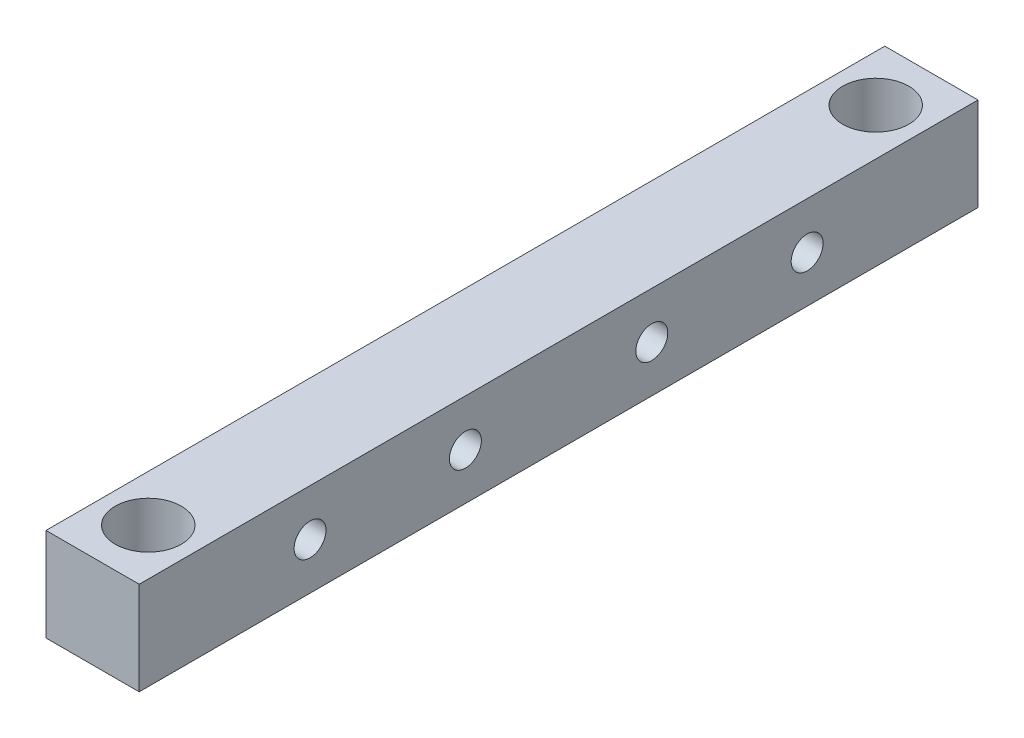
from build123d import *

# Parameters (mm, degrees)
SKETCH1_W               = 9.525
SKETCH1_H               = 9.525
BOSS_EXTRUDE1_DEPTH     = 42.8625
F_1_4_CLEARANCE_HOLE1_D = 6.7564
F_4_CLEARANCE_HOLE1_D   = 3.2639


with BuildPart() as part:
    # Sketch1 → Boss-Extrude1 (new, symmetric)
    with BuildSketch(Plane.XY):
        Rectangle(SKETCH1_W, SKETCH1_H)
    extrude(amount=BOSS_EXTRUDE1_DEPTH, both=True)

    # 1/4 Clearance Hole1 (through all)
    with Locations(Plane(origin=(0, 4.7625, 0), x_dir=(1, 0, 0), z_dir=(0, 1, 0))):
        with Locations((0, 37.1729)):
            f_1_4_clearance_hole1 = Hole(F_1_4_CLEARANCE_HOLE1_D / 2)

    # Mirror1: 1/4 Clearance Hole1 across plane
    add(f_1_4_clearance_hole1.mirror(Plane.XY), mode=Mode.SUBTRACT)

    # #4 Clearance Hole1 (through all)
    with Locations(Plane(origin=(4.7625, 0, 0), x_dir=(0, 0, -1), z_dir=(1, 0, 0))):
        with Locations((9.525, 0), (25.4, 0)):
            f_4_clearance_hole1 = Hole(F_4_CLEARANCE_HOLE1_D / 2)

    # Mirror2: #4 Clearance Hole1 across plane
    add(f_4_clearance_hole1.mirror(Plane.XY), mode=Mode.SUBTRACT)


solid = part.part
